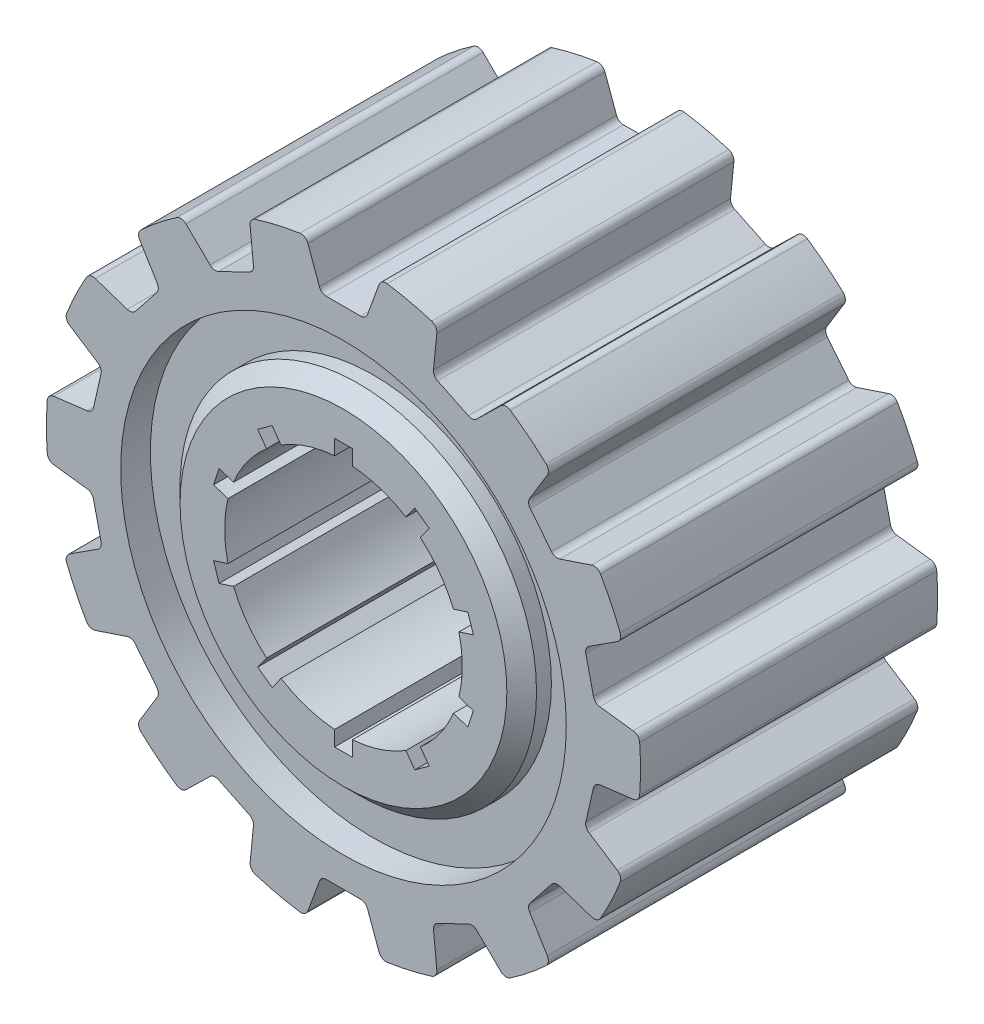
from build123d import *

# Parameters (mm, degrees)
SKETCH1_R           = 10
BOSS_EXTRUDE1_DEPTH = 10
CUT_EXTRUDE1_DEPTH  = 18.320508076
CIRPATTERN1_COUNT   = 14
CUT_EXTRUDE2_START  = -4
SKETCH3_R           = 7.5
SKETCH3_R_2         = 6
CUT_EXTRUDE2_DEPTH  = 11.946425093
CHAMFER1_SIZE       = 0.5
CHAMFER2_SIZE       = 0.5
FILLET1_R           = 0.25


with BuildPart() as part:
    # Sketch1 → Boss-Extrude1 (new body)
    with BuildSketch(Plane.XY):
        Circle(SKETCH1_R)
        with BuildLine():
            Line((2.887738734, 3.464240899), (2.402328537, 3.81691205))
            Line((2.402328537, 3.81691205), (2.101814002, 3.403289277))
            ThreePointArc((2.101814002, 3.403289277), (1.236067977, 3.804226065), (0.3, 3.988734135))
            Line((0.3, 3.988734135), (0.3, 4.5))
            Line((0.3, 4.5), (-0.3, 4.5))
            Line((-0.3, 4.5), (-0.3, 3.988734135))
            ThreePointArc((-0.3, 3.988734135), (-1.236067977, 3.804226065), (-2.101814002, 3.403289277))
            Line((-2.101814002, 3.403289277), (-2.402328537, 3.81691205))
            Line((-2.402328537, 3.81691205), (-2.887738734, 3.464240899))
            Line((-2.887738734, 3.464240899), (-2.587224198, 3.050618126))
            ThreePointArc((-2.587224198, 3.050618126), (-3.236067977, 2.351141009), (-3.700806493, 1.517903589))
            Line((-3.700806493, 1.517903589), (-4.187049225, 1.67589343))
            Line((-4.187049225, 1.67589343), (-4.372459422, 1.10525952))
            Line((-4.372459422, 1.10525952), (-3.886216689, 0.947269679))
            ThreePointArc((-3.886216689, 0.947269679), (-4, 0), (-3.886216689, -0.947269679))
            Line((-3.886216689, -0.947269679), (-4.372459422, -1.10525952))
            Line((-4.372459422, -1.10525952), (-4.187049225, -1.67589343))
            Line((-4.187049225, -1.67589343), (-3.700806493, -1.517903589))
            ThreePointArc((-3.700806493, -1.517903589), (-3.236067977, -2.351141009), (-2.587224198, -3.050618126))
            Line((-2.587224198, -3.050618126), (-2.887738734, -3.464240899))
            Line((-2.887738734, -3.464240899), (-2.402328537, -3.81691205))
            Line((-2.402328537, -3.81691205), (-2.101814002, -3.403289277))
            ThreePointArc((-2.101814002, -3.403289277), (-1.236067977, -3.804226065), (-0.3, -3.988734135))
            Line((-0.3, -3.988734135), (-0.3, -4.5))
            Line((-0.3, -4.5), (0.3, -4.5))
            Line((0.3, -4.5), (0.3, -3.988734135))
            ThreePointArc((0.3, -3.988734135), (1.236067977, -3.804226065), (2.101814002, -3.403289277))
            Line((2.101814002, -3.403289277), (2.402328537, -3.81691205))
            Line((2.402328537, -3.81691205), (2.887738734, -3.464240899))
            Line((2.887738734, -3.464240899), (2.587224198, -3.050618126))
            ThreePointArc((2.587224198, -3.050618126), (3.236067977, -2.351141009), (3.700806493, -1.517903589))
            Line((3.700806493, -1.517903589), (4.187049225, -1.67589343))
            Line((4.187049225, -1.67589343), (4.372459422, -1.10525952))
            Line((4.372459422, -1.10525952), (3.886216689, -0.947269679))
            ThreePointArc((3.886216689, -0.947269679), (4, 0), (3.886216689, 0.947269679))
            Line((3.886216689, 0.947269679), (4.372459422, 1.10525952))
            Line((4.372459422, 1.10525952), (4.187049225, 1.67589343))
            Line((4.187049225, 1.67589343), (3.700806493, 1.517903589))
            ThreePointArc((3.700806493, 1.517903589), (3.236067977, 2.351141009), (2.587224198, 3.050618126))
            Line((2.587224198, 3.050618126), (2.887738734, 3.464240899))
        make_face(mode=Mode.SUBTRACT)
    extrude(amount=BOSS_EXTRUDE1_DEPTH)

    # Sketch2 → Cut-Extrude1 (cut, through all)
    with BuildSketch(Plane.XY.offset(10)):
        with BuildLine():
            Line((-0.75, 8.5), (0, 8.5))
            Line((0, 8.5), (0, 10))
            ThreePointArc((0, 10), (-0.634599116, 9.979843885), (-1.266640021, 9.919456792))
            Line((-1.266640021, 9.919456792), (-0.75, 8.5))
        make_face()
        with BuildLine():
            Line((0, 10), (0, 8.5))
            Line((0, 8.5), (0.75, 8.5))
            Line((0.75, 8.5), (1.266640021, 9.919456792))
            ThreePointArc((1.266640021, 9.919456792), (0.634599116, 9.979843885), (0, 10))
        make_face()
    cut_extrude1 = extrude(amount=-CUT_EXTRUDE1_DEPTH, mode=Mode.SUBTRACT)

    # CirPattern1: Cut-Extrude1 ×14 about axis
    cirpattern1_axis = Axis((0, 0, 0), (0, 0, 1))
    for i in range(1, CIRPATTERN1_COUNT):
        add(cut_extrude1.rotate(cirpattern1_axis, i * 360 / CIRPATTERN1_COUNT), mode=Mode.SUBTRACT)

    # Sketch3 → Cut-Extrude2 (cut, through all)
    with BuildSketch(Plane.XY.offset(5).offset(CUT_EXTRUDE2_START)):
        Circle(SKETCH3_R)
        Circle(SKETCH3_R_2, mode=Mode.SUBTRACT)
    cut_extrude2 = extrude(amount=-CUT_EXTRUDE2_DEPTH, mode=Mode.SUBTRACT)

    # Chamfer1
    chamfer1_edges = [part.edges().sort_by_distance(p)[0] for p in [
        (-6, 0, 0),
    ]]
    chamfer(chamfer1_edges, length=CHAMFER1_SIZE)

    # Mirror1: Cut-Extrude2 across plane
    add(cut_extrude2.mirror(Plane.XY.offset(5)), mode=Mode.SUBTRACT)

    # Chamfer2
    chamfer2_edges = [part.edges().sort_by_distance(p)[0] for p in [
        (-6, 0, 10),
    ]]
    chamfer(chamfer2_edges, length=CHAMFER2_SIZE)

    # Fillet1
    fillet1_edges = [part.edges().sort_by_distance(p)[0] for p in [
        (0.75, 8.5, 5),
        (-0.75, 8.5, 5),
        (-1.266640021, 9.919456792, 5),
        (1.266640021, 9.919456792, 5),
        (-6.17795025, 5.886036928, 5),
        (-7.113184952, 4.713289704, 5),
        (-8.545080745, 5.194381104, 5),
        (-6.965606473, 7.174979196, 5),
        (-8.119996553, 2.622623873, 5),
        (-8.453777954, 1.160232004, 5),
        (-9.952609221, 0.972404078, 5),
        (-9.38890138, 3.442169501, 5),
        (-8.453777954, -1.160232004, 5),
        (-8.119996553, -2.622623873, 5),
        (-9.38890138, -3.442169501, 5),
        (-9.952609221, -0.972404078, 5),
        (-7.113184952, -4.713289704, 5),
        (-6.17795025, -5.886036928, 5),
        (-6.965606473, -7.174979196, 5),
        (-8.545080745, -5.194381104, 5),
        (-4.363738433, -7.332822573, 5),
        (-3.012285132, -7.983648182, 5),
        (-3.162687777, -9.486696265, 5),
        (-5.445094229, -8.387547248, 5),
        (-0.75, -8.5, 5),
        (0.75, -8.5, 5),
        (1.266640021, -9.919456792, 5),
        (-1.266640021, -9.919456792, 5),
        (3.012285132, -7.983648182, 5),
        (4.363738433, -7.332822573, 5),
        (5.445094229, -8.387547248, 5),
        (3.162687777, -9.486696265, 5),
        (6.17795025, -5.886036928, 5),
        (7.113184952, -4.713289704, 5),
        (8.545080745, -5.194381104, 5),
        (6.965606473, -7.174979196, 5),
        (8.119996553, -2.622623873, 5),
        (8.453777954, -1.160232004, 5),
        (9.952609221, -0.972404078, 5),
        (9.38890138, -3.442169501, 5),
        (8.453777954, 1.160232004, 5),
        (8.119996553, 2.622623873, 5),
        (9.38890138, 3.442169501, 5),
        (9.952609221, 0.972404078, 5),
        (7.113184952, 4.713289704, 5),
        (6.17795025, 5.886036928, 5),
        (6.965606473, 7.174979196, 5),
        (8.545080745, 5.194381104, 5),
        (4.363738433, 7.332822573, 5),
        (3.012285132, 7.983648182, 5),
        (3.162687777, 9.486696265, 5),
        (5.445094229, 8.387547248, 5),
        (-3.012285132, 7.983648182, 5),
        (-4.363738433, 7.332822573, 5),
        (-5.445094229, 8.387547248, 5),
        (-3.162687777, 9.486696265, 5),
    ]]
    fillet(fillet1_edges, radius=FILLET1_R)


solid = part.part
